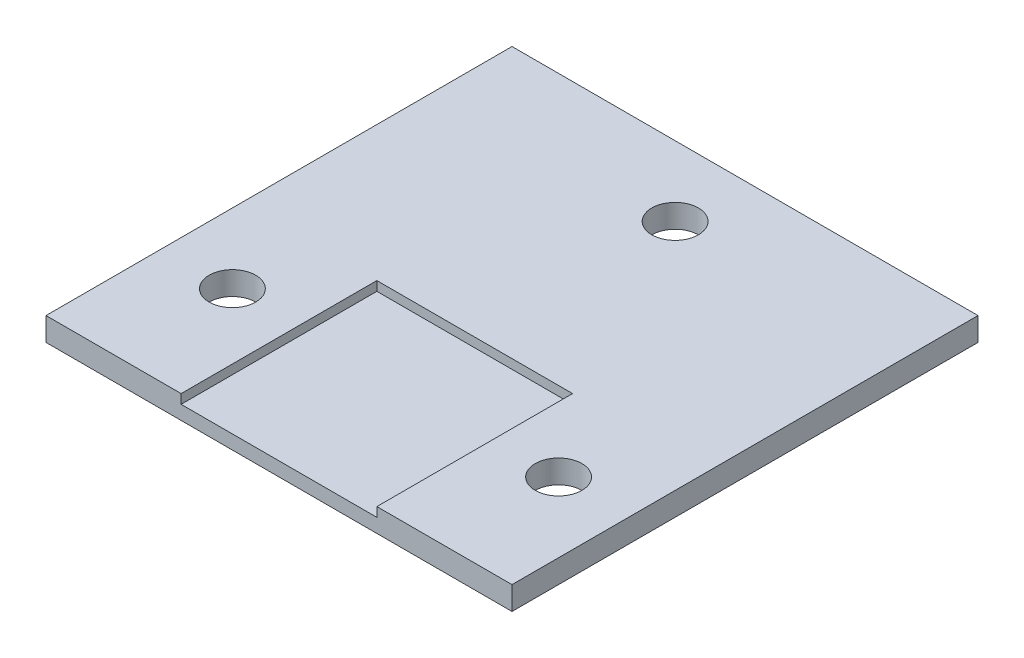
from build123d import *

# Parameters (mm, degrees)
SKETCH1_W           = 100
SKETCH1_H           = 100
BOSS_EXTRUDE1_DEPTH = 5
SKETCH2_W           = 42
SKETCH2_H           = 42
CUT_EXTRUDE1_DEPTH  = 2
SKETCH3_R           = 5
CUT_EXTRUDE2_DEPTH  = 5


with BuildPart() as part:
    # Sketch1 → Boss-Extrude1 (new body)
    with BuildSketch(Plane(origin=(0, 0, 0), x_dir=(1, 0, 0), z_dir=(0, 1, 0))):
        Rectangle(SKETCH1_W, SKETCH1_H)
    extrude(amount=BOSS_EXTRUDE1_DEPTH)

    # Sketch2 → Cut-Extrude1 (cut)
    with BuildSketch(Plane(origin=(0, 5, 0), x_dir=(1, 0, 0), z_dir=(0, 1, 0))):
        with Locations((0, -29)):
            Rectangle(SKETCH2_W, SKETCH2_H)
    extrude(amount=-CUT_EXTRUDE1_DEPTH, mode=Mode.SUBTRACT)

    # Sketch3 → Cut-Extrude2 (cut)
    with BuildSketch(Plane(origin=(0, 5, 0), x_dir=(1, 0, 0), z_dir=(0, 1, 0))):
        with Locations(Location((-35, -25, 0), (0, 0, 270))):
            Circle(SKETCH3_R)
        with Locations(Location((35, -25, 0), (0, 0, 270))):
            Circle(SKETCH3_R)
        with Locations(Location((0, 35, 0), (0, 0, 270))):
            Circle(SKETCH3_R)
    extrude(amount=-CUT_EXTRUDE2_DEPTH, mode=Mode.SUBTRACT)


solid = part.part
